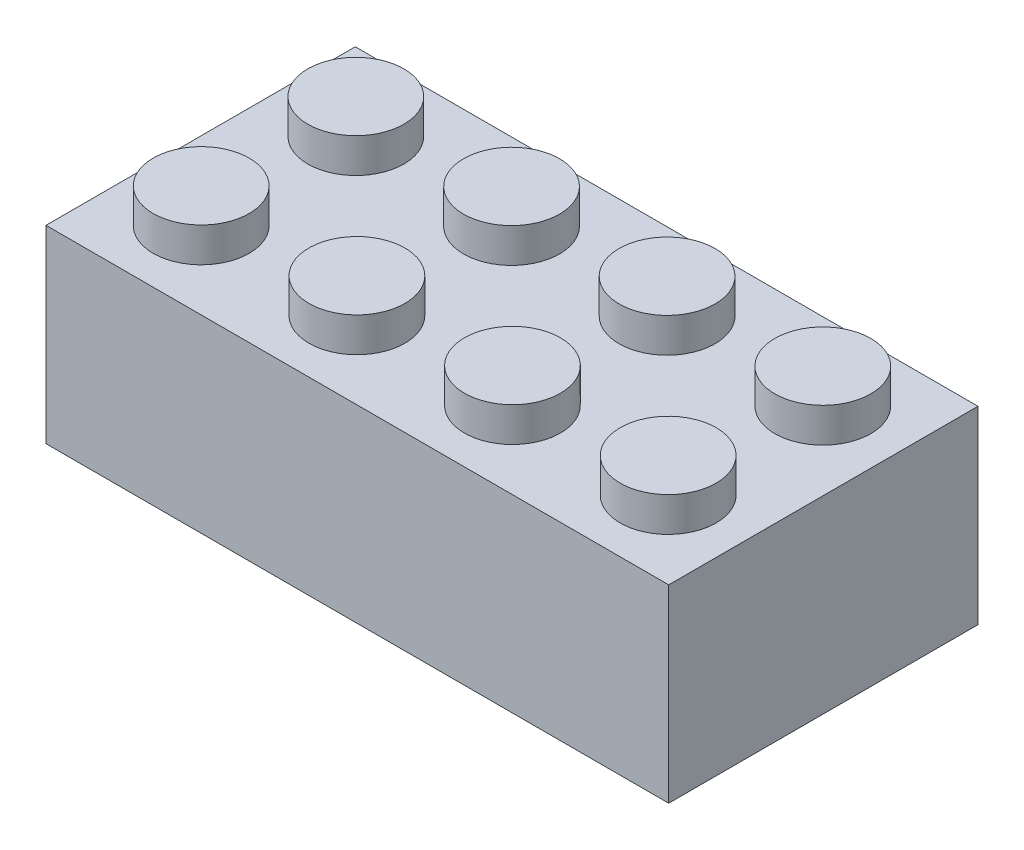
from build123d import *

# Parameters (mm, degrees)
SKETCH2_W           = 31.77
SKETCH2_H           = 15.78
BOSS_EXTRUDE2_DEPTH = 9.65
SKETCH3_R           = 2.45
BOSS_EXTRUDE3_DEPTH = 1.76
SHELL1_T            = -1.2
SKETCH4_R           = 3.215
SKETCH4_R_2         = 2.305
BOSS_EXTRUDE4_DEPTH = 8.25


with BuildPart() as part:
    # Sketch2 → Boss-Extrude2 (new body)
    with BuildSketch(Plane(origin=(0, 0, 0), x_dir=(1, 0, 0), z_dir=(0, 1, 0))):
        Rectangle(SKETCH2_W, SKETCH2_H)
    extrude(amount=-BOSS_EXTRUDE2_DEPTH)

    # Sketch3 → Boss-Extrude3 (add)
    with BuildSketch(Plane(origin=(0, 0, 0), x_dir=(1, 0, 0), z_dir=(0, 1, 0))):
        with Locations(Location((-11.9125, 3.945, 0), (0, 0, 270))):
            Circle(SKETCH3_R)
        with Locations(Location((-3.9675, 3.945, 0), (0, 0, 270))):
            Circle(SKETCH3_R)
        with Locations(Location((-3.9675, -3.945, 0), (0, 0, 270))):
            Circle(SKETCH3_R)
        with Locations(Location((-11.9125, -3.945, 0), (0, 0, 270))):
            Circle(SKETCH3_R)
        with Locations(Location((11.9125, -3.945, 0), (0, 0, 90))):
            Circle(SKETCH3_R)
        with Locations(Location((3.9675, -3.945, 0), (0, 0, 90))):
            Circle(SKETCH3_R)
        with Locations(Location((3.9675, 3.945, 0), (0, 0, 90))):
            Circle(SKETCH3_R)
        with Locations(Location((11.9125, 3.945, 0), (0, 0, 90))):
            Circle(SKETCH3_R)
    extrude(amount=BOSS_EXTRUDE3_DEPTH)

    # Shell1
    shell1_openings = [part.faces().sort_by_distance(p)[0] for p in [
        (0, -9.65, 0),
    ]]
    offset(amount=SHELL1_T, openings=shell1_openings, kind=Kind.INTERSECTION)

    # Sketch4 → Boss-Extrude4 (add)
    # profile 1 of 3: a face of its own
    with BuildSketch(Plane.XZ.offset(1.2)):
        with Locations(Location((0, 0, 0), (0, 0, 90))):
            Circle(SKETCH4_R)
        with Locations(Location((0, 0, 0), (0, 0, 90))):
            Circle(SKETCH4_R_2, mode=Mode.SUBTRACT)
    # profile 2 of 3: a face of its own
    with BuildSketch(Plane.XZ.offset(1.2)):
        with Locations(Location((7.945, 0, 0), (0, 0, 90))):
            Circle(SKETCH4_R)
        with Locations(Location((7.945, 0, 0), (0, 0, 90))):
            Circle(SKETCH4_R_2, mode=Mode.SUBTRACT)
    # profile 3 of 3: a face of its own
    with BuildSketch(Plane.XZ.offset(1.2)):
        with Locations(Location((-7.945, 0, 0), (0, 0, 90))):
            Circle(SKETCH4_R)
        with Locations(Location((-7.945, 0, 0), (0, 0, 90))):
            Circle(SKETCH4_R_2, mode=Mode.SUBTRACT)
    extrude(amount=BOSS_EXTRUDE4_DEPTH)


solid = part.part
